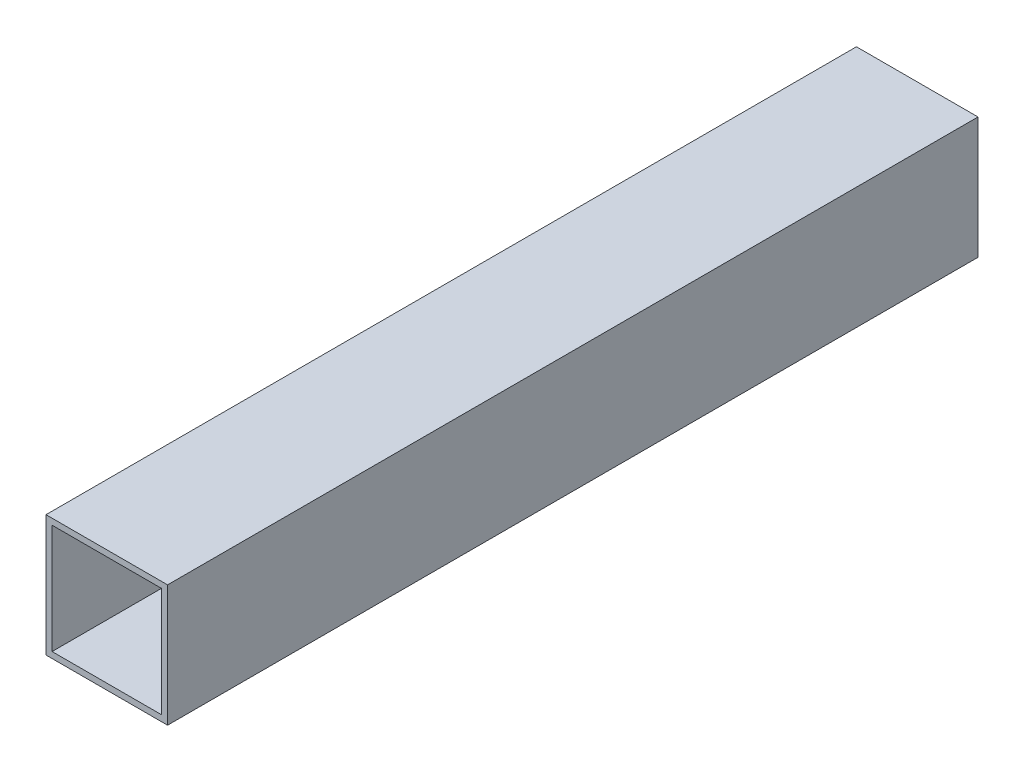
from build123d import *

# Parameters (mm, degrees)
SKETCH1_W           = 30
SKETCH1_H           = 30
SKETCH1_W_2         = 27
SKETCH1_H_2         = 27
BOSS_EXTRUDE1_DEPTH = 200


with BuildPart() as part:
    # Sketch1 → Boss-Extrude1 (new body)
    with BuildSketch(Plane.XY):
        with Locations((15, 15)):
            Rectangle(SKETCH1_W, SKETCH1_H)
        with Locations((15, 15)):
            Rectangle(SKETCH1_W_2, SKETCH1_H_2, mode=Mode.SUBTRACT)
    extrude(amount=BOSS_EXTRUDE1_DEPTH)


solid = part.part
